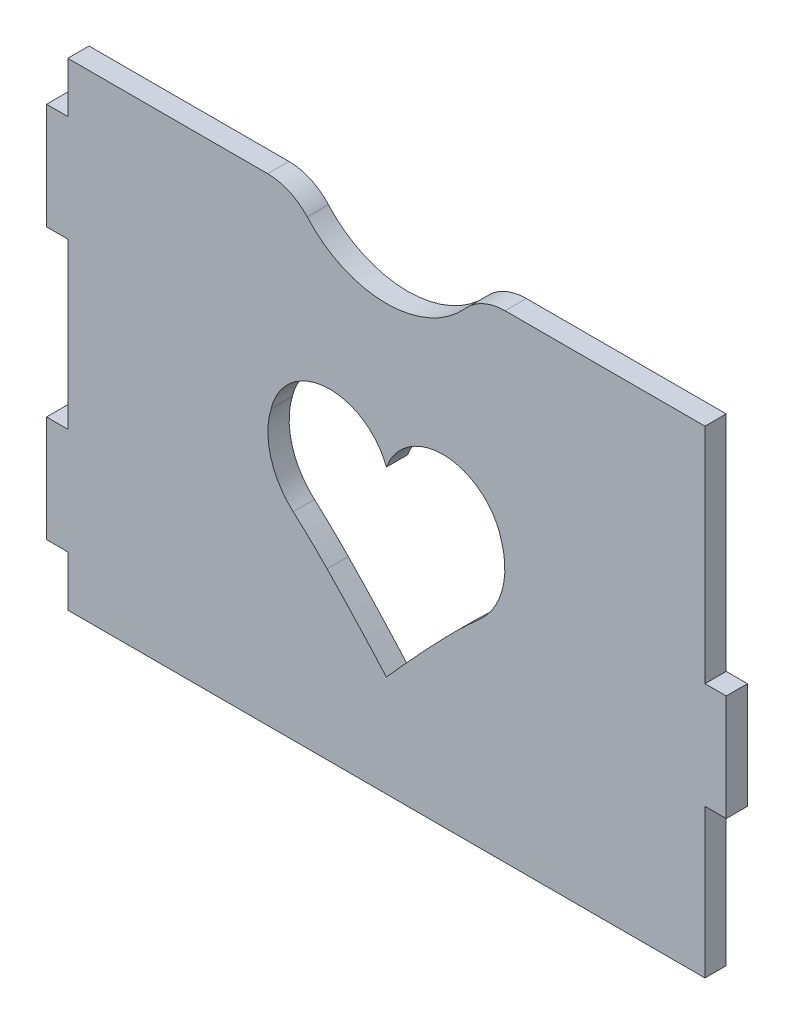
from build123d import *

# Parameters (mm, degrees)
SKETCH_1_W      = 4
SKETCH_1_H      = 20
EXTRUDE_1_DEPTH = 4


with BuildPart() as part:
    # Эскиз1 → Бобышка-Вытянуть1 (new body)
    # profile 1 of 4: a face of its own
    with BuildSketch(Plane.XY):
        with BuildLine():
            Line((-60, 45), (-22.360679775, 45))
            ThreePointArc((-22.360679775, 45), (-18.27819687, 44.128709292), (-14.90711985, 41.666666667))
            ThreePointArc((-14.90711985, 41.666666667), (0, 35), (14.90711985, 41.666666667))
            ThreePointArc((14.90711985, 41.666666667), (18.27819687, 44.128709292), (22.360679775, 45))
            Line((22.360679775, 45), (60, 45))
            Line((60, 45), (60, -45))
            Line((60, -45), (-60, -45))
            Line((-60, -45), (-60, 45))
        make_face()
        with BuildLine():
            ThreePointArc((0, 8.325008306), (-11.322126202, 15.697320009), (-21.693624825, 7.038593896))
            ThreePointArc((-21.693624825, 7.038593896), (-21.780397742, -0.950934053), (-17.546591805, -7.726992913))
            ThreePointArc((-17.546591805, -7.726992913), (-14.298596462, -10.729197825), (-11.163444206, -13.849058145))
            ThreePointArc((-11.163444206, -13.849058145), (-5.512041052, -19.820511257), (0, -25.920840209))
            ThreePointArc((0, -25.920840209), (5.512041052, -19.820511257), (11.163444206, -13.849058145))
            ThreePointArc((11.163444206, -13.849058145), (14.298596462, -10.729197825), (17.546591805, -7.726992913))
            ThreePointArc((17.546591805, -7.726992913), (21.780397742, -0.950934053), (21.693624825, 7.038593896))
            ThreePointArc((21.693624825, 7.038593896), (11.322126202, 15.697320009), (0, 8.325008306))
        make_face(mode=Mode.SUBTRACT)
    # profile 2 of 4: a face of its own
    with BuildSketch(Plane.XY):
        with Locations((-62, -25.5)):
            Rectangle(SKETCH_1_W, SKETCH_1_H)
    # profile 3 of 4: a face of its own
    with BuildSketch(Plane.XY):
        with Locations((-62, 25.5)):
            Rectangle(SKETCH_1_W, SKETCH_1_H)
    # profile 4 of 4: a face of its own
    with BuildSketch(Plane.XY):
        with Locations((62, -7)):
            Rectangle(SKETCH_1_W, SKETCH_1_H)
    extrude(amount=EXTRUDE_1_DEPTH)


solid = part.part
